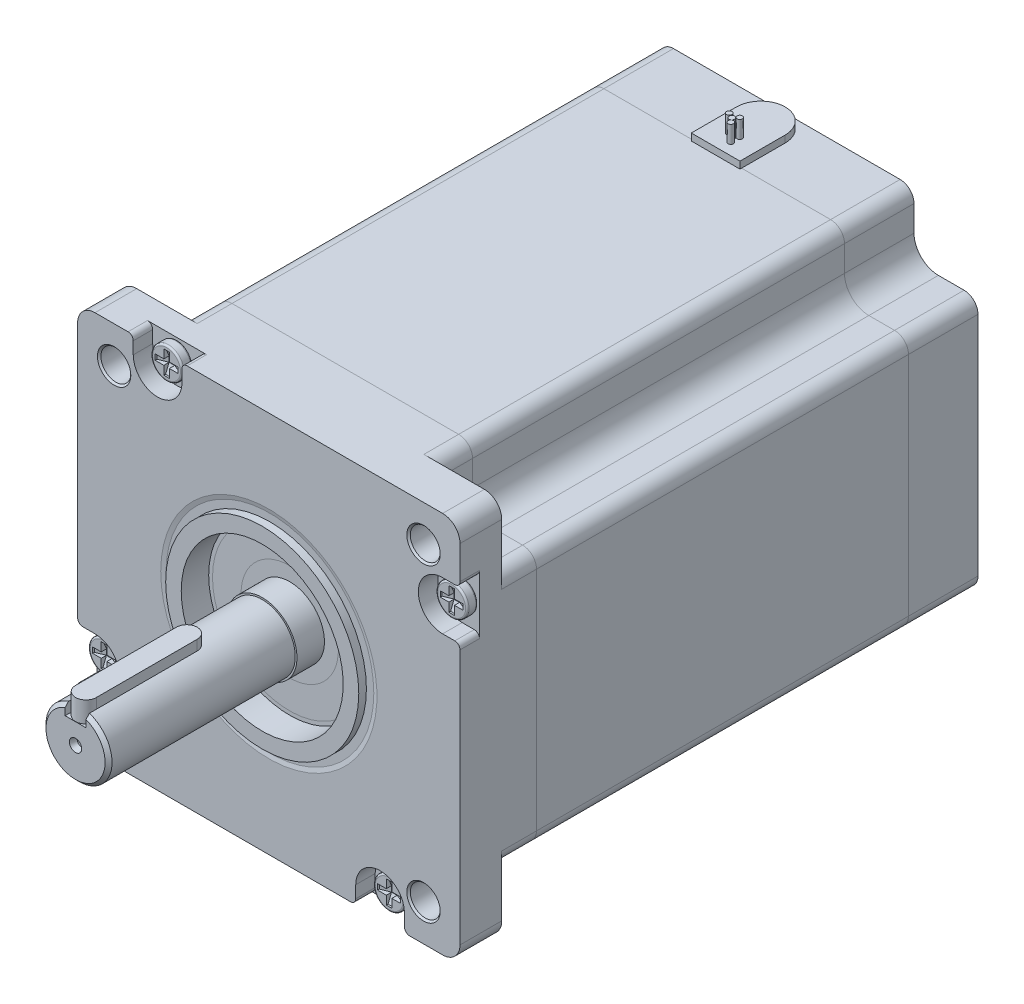
from build123d import *

# Parameters (mm, degrees)
SKETCH1_R             = 4.3
BOSS_EXTRUDE1_DEPTH   = 22
CUT_EXTRUDE1_DEPTH    = 10
CHAMFER1_SIZE         = 0.5
CUT_EXTRUDE2_DEPTH    = 5.6
FILLET1_R             = 1.5
SKETCH6_R             = 27.775
BOSS_EXTRUDE2_DEPTH   = 1.9
SKETCH7_W             = 7.9
SKETCH7_H             = 13.3
SKETCH9_R             = 9.5
BOSS_EXTRUDE3_DEPTH   = 53.7
CHAMFER2_SIZE         = 1
SKETCH11_W            = 6
SKETCH11_H            = 7.2
CUT_EXTRUDE3_DEPTH    = 35
FILLET2_R             = 2.95
BOSS_EXTRUDE4_DEPTH   = 6
SKETCH13_R            = 1.269531582
CUT_EXTRUDE4_DEPTH    = 5
CHAMFER3_SIZE         = 0.5
CHAMFER3_SIZE2        = 1.743707222
CIRPATTERN2_COUNT     = 4
FILLET3_R             = 1.5
SKETCH14_R            = 4.5
BOSS_EXTRUDE5_DEPTH   = 3
FILLET4_R             = 0.5
CUT_EXTRUDE5_DEPTH    = 1.5
CHAMFER4_SIZE         = 1
CHAMFER4_SIZE2        = 2.475086853
CHAMFER4_PART_2_SIZE  = 1
CHAMFER4_PART_2_SIZE2 = 2.475086853
CHAMFER4_PART_3_SIZE  = 1
CHAMFER4_PART_3_SIZE2 = 2.475086853
CHAMFER4_PART_4_SIZE  = 1
CHAMFER4_PART_4_SIZE2 = 2.475086853
CIRPATTERN3_COUNT     = 4
BOSS_EXTRUDE6_DEPTH   = 107
BOSS_EXTRUDE7_DEPTH   = 20
SKETCH18_R            = 17.5
CUT_EXTRUDE6_DEPTH    = 4.6
BOSS_EXTRUDE8_DEPTH   = 2
SKETCH20_R            = 0.781757385
SKETCH20_R_2          = 0.755744111
SKETCH20_R_3          = 0.777591317
BOSS_EXTRUDE9_DEPTH   = 5


with BuildPart() as part:
    # Sketch1 → Boss-Extrude1 (new body)
    with BuildSketch(Plane.XY):
        with BuildLine():
            Line((50, -55), (-50, -55))
            ThreePointArc((-50, -55), (-53.535533906, -53.535533906), (-55, -50))
            Line((-55, -50), (-55, 50))
            ThreePointArc((-55, 50), (-53.535533906, 53.535533906), (-50, 55))
            Line((-50, 55), (50, 55))
            ThreePointArc((50, 55), (53.535533906, 53.535533906), (55, 50))
            Line((55, 50), (55, -50))
            ThreePointArc((55, -50), (53.535533906, -53.535533906), (50, -55))
        make_face()
        with Locations((-44.5, 44.5)):
            Circle(SKETCH1_R, mode=Mode.SUBTRACT)
        with Locations((44.5, 44.5)):
            Circle(SKETCH1_R, mode=Mode.SUBTRACT)
        with Locations((-44.5, -44.5)):
            Circle(SKETCH1_R, mode=Mode.SUBTRACT)
        with Locations((44.5, -44.5)):
            Circle(SKETCH1_R, mode=Mode.SUBTRACT)
    extrude(amount=BOSS_EXTRUDE1_DEPTH)

    # Sketch2 → Cut-Extrude1 (cut)
    with BuildSketch(Plane(origin=(0, 0, 0), x_dir=(-1, 0, 0), z_dir=(0, 0, -1))):
        with BuildLine():
            Line((-51, 36.6), (-43.6, 36.6))
            ThreePointArc((-43.6, 36.6), (-38.650252532, 38.650252532), (-36.6, 43.6))
            Line((-36.6, 43.6), (-36.6, 51))
            ThreePointArc((-36.6, 51), (-35.428427125, 53.828427125), (-32.6, 55))
            Line((-32.6, 55), (-50, 55))
            ThreePointArc((-50, 55), (-53.535533906, 53.535533906), (-55, 50))
            Line((-55, 50), (-55, 32.6))
            ThreePointArc((-55, 32.6), (-53.828427125, 35.428427125), (-51, 36.6))
        make_face()
        with BuildLine():
            Line((55, 50), (55, 32.6))
            ThreePointArc((55, 32.6), (53.828427125, 35.428427125), (51, 36.6))
            Line((51, 36.6), (43.6, 36.6))
            ThreePointArc((43.6, 36.6), (38.650252532, 38.650252532), (36.6, 43.6))
            Line((36.6, 43.6), (36.6, 51))
            ThreePointArc((36.6, 51), (35.428427125, 53.828427125), (32.6, 55))
            Line((32.6, 55), (50, 55))
            ThreePointArc((50, 55), (53.535533906, 53.535533906), (55, 50))
        make_face()
        with BuildLine():
            Line((51, -36.6), (43.6, -36.6))
            ThreePointArc((43.6, -36.6), (38.650252532, -38.650252532), (36.6, -43.6))
            Line((36.6, -43.6), (36.6, -51))
            ThreePointArc((36.6, -51), (35.428427125, -53.828427125), (32.6, -55))
            Line((32.6, -55), (50, -55))
            ThreePointArc((50, -55), (53.535533906, -53.535533906), (55, -50))
            Line((55, -50), (55, -32.6))
            ThreePointArc((55, -32.6), (53.828427125, -35.428427125), (51, -36.6))
        make_face()
        with BuildLine():
            Line((-55, -50), (-55, -32.6))
            ThreePointArc((-55, -32.6), (-53.828427125, -35.428427125), (-51, -36.6))
            Line((-51, -36.6), (-43.6, -36.6))
            ThreePointArc((-43.6, -36.6), (-38.650252532, -38.650252532), (-36.6, -43.6))
            Line((-36.6, -43.6), (-36.6, -51))
            ThreePointArc((-36.6, -51), (-35.428427125, -53.828427125), (-32.6, -55))
            Line((-32.6, -55), (-50, -55))
            ThreePointArc((-50, -55), (-53.535533906, -53.535533906), (-55, -50))
        make_face()
    extrude(amount=-CUT_EXTRUDE1_DEPTH, mode=Mode.SUBTRACT)

    # Chamfer1
    chamfer1_edges = [part.edges().sort_by_distance(p)[0] for p in [
        (-48.8, 44.5, 10),
        (-48.8, 44.5, 22),
        (40.2, 44.5, 22),
        (-48.8, -44.5, 22),
        (40.2, -44.5, 22),
        (40.2, -44.5, 10),
        (-48.8, -44.5, 10),
        (40.2, 44.5, 10),
    ]]
    chamfer(chamfer1_edges, length=CHAMFER1_SIZE)

    # Sketch3 → Cut-Extrude2 (cut)
    with BuildSketch(Plane.XY.offset(22)):
        with BuildLine():
            Line((-39, 50), (-39, 60.599803572))
            Line((-39, 60.599803572), (-25, 60.599803572))
            Line((-25, 60.599803572), (-25, 50))
            ThreePointArc((-25, 50), (-32, 43), (-39, 50))
        make_face()
    cut_extrude2 = extrude(amount=-CUT_EXTRUDE2_DEPTH, mode=Mode.SUBTRACT)

    # Fillet1
    fillet1_edges = [part.edges().sort_by_distance(p)[0] for p in [
        (-39, 55, 19.2),
        (-25, 55, 19.2),
    ]]
    fillet(fillet1_edges, radius=FILLET1_R)

    # Sketch6 → Boss-Extrude2 (add)
    with BuildSketch(Plane.XY.offset(22)):
        with Locations(Location((0, 0, 0), (0, 0, 180))):
            Circle(SKETCH6_R)
    extrude(amount=BOSS_EXTRUDE2_DEPTH)

    # Sketch7 → Cut-Revolve1 (revolve, cut)
    with BuildSketch(Plane(origin=(0, 0, 0), x_dir=(0, 0, -1), z_dir=(1, 0, 0)), mode=Mode.PRIVATE) as cut_revolve1_sk:
        Polygon((-22, 27.775), (-21.7, 27.775), (-21.7, 29.9), (-22, 31.1), align=None)
        with Locations((-19.95, 16.65)):
            Rectangle(SKETCH7_W, SKETCH7_H)
    revolve(cut_revolve1_sk.sketch.rotate(Axis((0, 0, 0), (0, 0, 1)), 90), axis=Axis((0, 0, 0), (0, 0, 1)), mode=Mode.SUBTRACT)

    # Sketch9 → Boss-Extrude3 (add)
    with BuildSketch(Plane.XY.offset(23.9)):
        with Locations(Location((0, 0, 0), (0, 0, 180))):
            Circle(SKETCH9_R)
    extrude(amount=BOSS_EXTRUDE3_DEPTH)

    # Chamfer2
    chamfer2_edges = [part.edges().sort_by_distance(p)[0] for p in [
        (9.5, 0, 77.6),
    ]]
    chamfer(chamfer2_edges, length=CHAMFER2_SIZE)

    # Sketch11 → Cut-Extrude3 (cut)
    with BuildSketch(Plane.XY.offset(77.6)):
        with Locations((0, 9.5)):
            Rectangle(SKETCH11_W, SKETCH11_H)
    extrude(amount=-CUT_EXTRUDE3_DEPTH, mode=Mode.SUBTRACT)

    # Fillet2
    fillet2_edges = [part.edges().sort_by_distance(p)[0] for p in [
        (-3, 7.456939094, 42.6),
        (3, 7.456939094, 42.6),
    ]]
    fillet(fillet2_edges, radius=FILLET2_R)

    # Sketch13 → Cut-Extrude4 (cut)
    with BuildSketch(Plane.XY.offset(77.6)):
        Circle(SKETCH13_R)
    extrude(amount=-CUT_EXTRUDE4_DEPTH, mode=Mode.SUBTRACT)

    # Chamfer3
    chamfer3_edges = [part.edges().sort_by_distance(p)[0] for p in [
        (-1.269531582, 0, 77.6),
    ]]
    chamfer3_side = [part.faces().sort_by_distance(p)[0] for p in [
        (-3.23657996, 6.92649343, 77.6),
    ]]
    chamfer(chamfer3_edges, length=CHAMFER3_SIZE, length2=CHAMFER3_SIZE2, reference=chamfer3_side[0])

    # CirPattern2: Cut-Extrude2 ×4 about axis
    cirpattern2_axis = Axis((0, 0, 0), (0, 0, 1))
    for i in range(1, CIRPATTERN2_COUNT):
        add(cut_extrude2.rotate(cirpattern2_axis, i * 360 / CIRPATTERN2_COUNT), mode=Mode.SUBTRACT)

    # Fillet3
    fillet3_edges = [part.edges().sort_by_distance(p)[0] for p in [
        (55, 25, 19.2),
        (55, 39, 19.2),
        (25, -55, 19.2),
        (39, -55, 19.2),
        (-55, -25, 19.2),
        (-55, -39, 19.2),
    ]]
    fillet(fillet3_edges, radius=FILLET3_R)


with BuildPart() as body_2:
    # Sketch12 → Boss-Extrude4 (new body)
    with BuildSketch(Plane(origin=(0, 5.9, 0), x_dir=(1, 0, 0), z_dir=(0, 1, 0))):
        with BuildLine():
            Line((2.95, -45.55), (2.95, -74.55))
            ThreePointArc((2.95, -74.55), (-0.05, -77.55), (-3.05, -74.55))
            Line((-3.05, -74.55), (-3.05, -45.55))
            ThreePointArc((-3.05, -45.55), (-0.05, -42.55), (2.95, -45.55))
        make_face()
    extrude(amount=BOSS_EXTRUDE4_DEPTH)


with BuildPart() as body_3:
    # Sketch14 → Boss-Extrude5 (new body)
    with BuildSketch(Plane.XY.offset(16.4)):
        with Locations((-32, 50)):
            Circle(SKETCH14_R)
    extrude(amount=BOSS_EXTRUDE5_DEPTH)

    # Fillet4
    fillet4_edges = [body_3.edges().sort_by_distance(p)[0] for p in [
        (-36.5, 50, 16.4),
        (-36.5, 50, 19.4),
    ]]
    fillet(fillet4_edges, radius=FILLET4_R)

    # Sketch15 → Cut-Extrude5 (cut)
    with BuildSketch(Plane.XY.offset(19.4)):
        Polygon((-31.205841701, 50.806748085), (-28.673829712, 50.806748085), (-28.673829712, 49.193251915), (-31.205841701, 49.193251915), (-31.205841701, 46.725736586), (-32.794158299, 46.725736586), (-32.794158299, 49.193251915), (-35.326170288, 49.193251915), (-35.326170288, 50.806748085), (-32.794158299, 50.806748085), (-32.794158299, 53.274263414), (-31.205841701, 53.274263414), align=None)
    extrude(amount=-CUT_EXTRUDE5_DEPTH, mode=Mode.SUBTRACT)

    # Chamfer4
    chamfer4_edges = [body_3.edges().sort_by_distance(p)[0] for p in [
        (-32, 46.725736586, 17.9),
    ]]
    chamfer4_side = [body_3.faces().sort_by_distance(p)[0] for p in [
        (-32, 46.725736586, 18.65),
    ]]
    chamfer(chamfer4_edges, length=CHAMFER4_SIZE, length2=CHAMFER4_SIZE2, reference=chamfer4_side[0])

    # Chamfer4 part 2
    chamfer4_part_2_edges = [body_3.edges().sort_by_distance(p)[0] for p in [
        (-32, 53.274263414, 17.9),
    ]]
    chamfer4_part_2_side = [body_3.faces().sort_by_distance(p)[0] for p in [
        (-32, 53.274263414, 18.65),
    ]]
    chamfer(chamfer4_part_2_edges, length=CHAMFER4_PART_2_SIZE, length2=CHAMFER4_PART_2_SIZE2, reference=chamfer4_part_2_side[0])

    # Chamfer4 part 3
    chamfer4_part_3_edges = [body_3.edges().sort_by_distance(p)[0] for p in [
        (-35.326170288, 50, 17.9),
    ]]
    chamfer4_part_3_side = [body_3.faces().sort_by_distance(p)[0] for p in [
        (-35.326170288, 50, 18.65),
    ]]
    chamfer(chamfer4_part_3_edges, length=CHAMFER4_PART_3_SIZE, length2=CHAMFER4_PART_3_SIZE2, reference=chamfer4_part_3_side[0])

    # Chamfer4 part 4
    chamfer4_part_4_edges = [body_3.edges().sort_by_distance(p)[0] for p in [
        (-28.673829712, 50, 17.9),
    ]]
    chamfer4_part_4_side = [body_3.faces().sort_by_distance(p)[0] for p in [
        (-28.673829712, 50, 18.65),
    ]]
    chamfer(chamfer4_part_4_edges, length=CHAMFER4_PART_4_SIZE, length2=CHAMFER4_PART_4_SIZE2, reference=chamfer4_part_4_side[0])


with BuildPart() as cirpattern3_1:
    # CirPattern3: pattern copy
    add(body_3.part.rotate(Axis((0, 0, 0), (0, 0, 1)), 1 * 360 / CIRPATTERN3_COUNT))


with BuildPart() as cirpattern3_2:
    # CirPattern3: pattern copy
    add(body_3.part.rotate(Axis((0, 0, 0), (0, 0, 1)), 2 * 360 / CIRPATTERN3_COUNT))


with BuildPart() as cirpattern3_3:
    # CirPattern3: pattern copy
    add(body_3.part.rotate(Axis((0, 0, 0), (0, 0, 1)), 3 * 360 / CIRPATTERN3_COUNT))


with BuildPart() as body_7:
    # Sketch16 → Boss-Extrude6 (new body)
    with BuildSketch(Plane(origin=(0, 0, 0), x_dir=(-1, 0, 0), z_dir=(0, 0, -1))):
        with BuildLine():
            Line((55, -32.6), (55, 32.6))
            ThreePointArc((55, 32.6), (53.828427125, 35.428427125), (51, 36.6))
            Line((51, 36.6), (43.6, 36.6))
            ThreePointArc((43.6, 36.6), (38.650252532, 38.650252532), (36.6, 43.6))
            Line((36.6, 43.6), (36.6, 51))
            ThreePointArc((36.6, 51), (35.428427125, 53.828427125), (32.6, 55))
            Line((32.6, 55), (-32.6, 55))
            ThreePointArc((-32.6, 55), (-35.428427125, 53.828427125), (-36.6, 51))
            Line((-36.6, 51), (-36.6, 43.6))
            ThreePointArc((-36.6, 43.6), (-38.650252532, 38.650252532), (-43.6, 36.6))
            Line((-43.6, 36.6), (-51, 36.6))
            ThreePointArc((-51, 36.6), (-53.828427125, 35.428427125), (-55, 32.6))
            Line((-55, 32.6), (-55, -32.6))
            ThreePointArc((-55, -32.6), (-53.828427125, -35.428427125), (-51, -36.6))
            Line((-51, -36.6), (-43.6, -36.6))
            ThreePointArc((-43.6, -36.6), (-38.650252532, -38.650252532), (-36.6, -43.6))
            Line((-36.6, -43.6), (-36.6, -51))
            ThreePointArc((-36.6, -51), (-35.428427125, -53.828427125), (-32.6, -55))
            Line((-32.6, -55), (32.6, -55))
            ThreePointArc((32.6, -55), (35.428427125, -53.828427125), (36.6, -51))
            Line((36.6, -51), (36.6, -43.6))
            ThreePointArc((36.6, -43.6), (38.650252532, -38.650252532), (43.6, -36.6))
            Line((43.6, -36.6), (51, -36.6))
            ThreePointArc((51, -36.6), (53.828427125, -35.428427125), (55, -32.6))
        make_face()
    extrude(amount=BOSS_EXTRUDE6_DEPTH)


with BuildPart() as body_8:
    # Sketch17 → Boss-Extrude7 (new body)
    with BuildSketch(Plane(origin=(0, 0, -107), x_dir=(-1, 0, 0), z_dir=(0, 0, -1))):
        with BuildLine():
            Line((55, -32.6), (55, 32.6))
            ThreePointArc((55, 32.6), (53.828427125, 35.428427125), (51, 36.6))
            Line((51, 36.6), (43.6, 36.6))
            ThreePointArc((43.6, 36.6), (38.650252532, 38.650252532), (36.6, 43.6))
            Line((36.6, 43.6), (36.6, 51))
            ThreePointArc((36.6, 51), (35.428427125, 53.828427125), (32.6, 55))
            Line((32.6, 55), (-32.6, 55))
            ThreePointArc((-32.6, 55), (-35.428427125, 53.828427125), (-36.6, 51))
            Line((-36.6, 51), (-36.6, 43.6))
            ThreePointArc((-36.6, 43.6), (-38.650252532, 38.650252532), (-43.6, 36.6))
            Line((-43.6, 36.6), (-51, 36.6))
            ThreePointArc((-51, 36.6), (-53.828427125, 35.428427125), (-55, 32.6))
            Line((-55, 32.6), (-55, -32.6))
            ThreePointArc((-55, -32.6), (-53.828427125, -35.428427125), (-51, -36.6))
            Line((-51, -36.6), (-43.6, -36.6))
            ThreePointArc((-43.6, -36.6), (-38.650252532, -38.650252532), (-36.6, -43.6))
            Line((-36.6, -43.6), (-36.6, -51))
            ThreePointArc((-36.6, -51), (-35.428427125, -53.828427125), (-32.6, -55))
            Line((-32.6, -55), (32.6, -55))
            ThreePointArc((32.6, -55), (35.428427125, -53.828427125), (36.6, -51))
            Line((36.6, -51), (36.6, -43.6))
            ThreePointArc((36.6, -43.6), (38.650252532, -38.650252532), (43.6, -36.6))
            Line((43.6, -36.6), (51, -36.6))
            ThreePointArc((51, -36.6), (53.828427125, -35.428427125), (55, -32.6))
        make_face()
    extrude(amount=BOSS_EXTRUDE7_DEPTH)

    # Sketch18 → Cut-Extrude6 (cut)
    with BuildSketch(Plane(origin=(0, 0, -127), x_dir=(-1, 0, 0), z_dir=(0, 0, -1))):
        Circle(SKETCH18_R)
    extrude(amount=-CUT_EXTRUDE6_DEPTH, mode=Mode.SUBTRACT)


with BuildPart() as body_9:
    # Sketch19 → Boss-Extrude8 (new body)
    with BuildSketch(Plane(origin=(0, 55, 0), x_dir=(1, 0, 0), z_dir=(0, 1, 0))):
        with BuildLine():
            Line((-7, 119.5319481), (-7, 106.5319481))
            Line((-7, 106.5319481), (7, 106.5319481))
            Line((7, 106.5319481), (7, 119.5319481))
            ThreePointArc((7, 119.5319481), (0, 126.5319481), (-7, 119.5319481))
        make_face()
    extrude(amount=BOSS_EXTRUDE8_DEPTH)

    # Sketch20 → Boss-Extrude9 (add)
    with BuildSketch(Plane(origin=(0, 57, 0), x_dir=(1, 0, 0), z_dir=(0, 1, 0))):
        with Locations(Location((-1.527965291, 111.959324304, 0), (0, 0, 270))):
            Circle(SKETCH20_R)
        with Locations(Location((0, 111.177566919, 0), (0, 0, 270))):
            Circle(SKETCH20_R)
        with Locations(Location((1.06638621, 112.393181791, 0), (0, 0, 270))):
            Circle(SKETCH20_R_2)
        with Locations(Location((0.985840453, 109.917406178, 0), (0, 0, 270))):
            Circle(SKETCH20_R_3)
    extrude(amount=BOSS_EXTRUDE9_DEPTH)


solid = Compound([part.part, body_2.part, body_3.part, cirpattern3_1.part, cirpattern3_2.part, cirpattern3_3.part, body_7.part, body_8.part, body_9.part])
